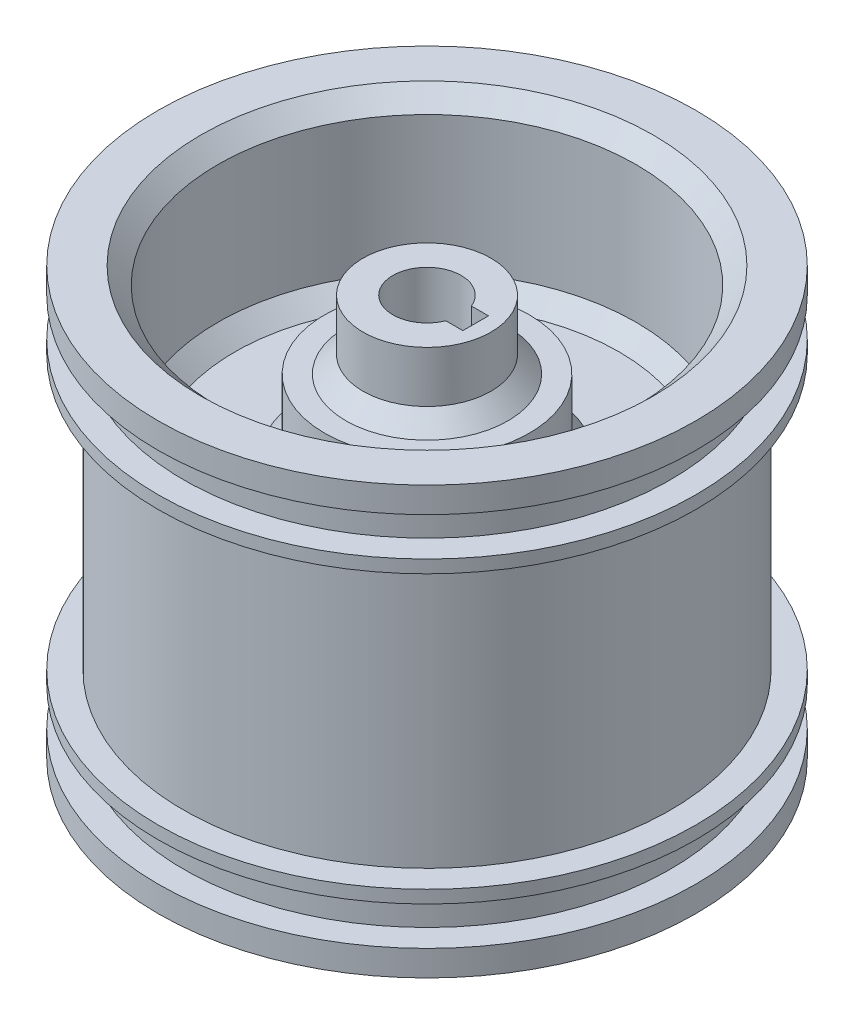
from build123d import *

# Parameters (mm, degrees)
CUT_EXTRUDE_1_DEPTH = 50
CUT_EXTRUDE_2_DEPTH = 8
CHAMFER_1_SIZE      = 2


with BuildPart() as part:
    # 草图1 → 旋转1 (revolve)
    with BuildSketch(Plane.XY, mode=Mode.PRIVATE) as revolve_1_sk:
        Polygon((24.5, -30), (24.5, -20), (12, -20), (12, -11), (7.5, -11), (7.5, -3), (0, -3), (0, -20), (0, -30), (0, -38), (10, -38), (10, -30), align=None)
        Polygon((31.5, 0), (24.5, 0), (24.5, -20), (24.5, -30), (28.5, -30), (28.5, -20), (28.5, -9), (31.5, -9), (31.5, -7.5), (28.5, -7.5), (28.5, -3), (31.5, -3), align=None)
        Polygon((28.5, -30), (24.5, -30), (24.5, -50), (31.5, -50), (31.5, -47), (28.5, -47), (28.5, -42.5), (31.5, -42.5), (31.5, -41), (28.5, -41), align=None)
    revolve(revolve_1_sk.sketch.rotate(Axis((0, 0, 0), (0, 1, 0)), 90), axis=Axis((0, 0, 0), (0, 1, 0)))

    # 草图2 → 切除-拉伸1 (cut)
    with BuildSketch(Plane(origin=(0, -3, 0), x_dir=(1, 0, 0), z_dir=(0, 1, 0))):
        with BuildLine():
            Line((5.7, 1.5), (3.708099244, 1.5))
            ThreePointArc((3.708099244, 1.5), (-4, 0), (3.708099244, -1.5))
            Line((3.708099244, -1.5), (5.7, -1.5))
            Line((5.7, -1.5), (5.7, 1.5))
        make_face()
    extrude(amount=-CUT_EXTRUDE_1_DEPTH, mode=Mode.SUBTRACT)

    # 草图3 → 切除-拉伸2 (cut)
    with BuildSketch(Plane.XZ.offset(38)):
        Polygon((6.92820323, 0), (3.464101615, 6), (-3.464101615, 6), (-6.92820323, 0), (-3.464101615, -6), (3.464101615, -6), align=None)
    extrude(amount=-CUT_EXTRUDE_2_DEPTH, mode=Mode.SUBTRACT)

    # 倒角1
    chamfer_1_edges = [part.edges().sort_by_distance(p)[0] for p in [
        (0, -11, 7.5),
        (0, -20, 12),
        (0, -20, 24.5),
        (0, 0, 24.5),
        (0, -50, 24.5),
        (0, -30, 24.5),
        (0, -30, 10),
    ]]
    chamfer(chamfer_1_edges, length=CHAMFER_1_SIZE)


solid = part.part
